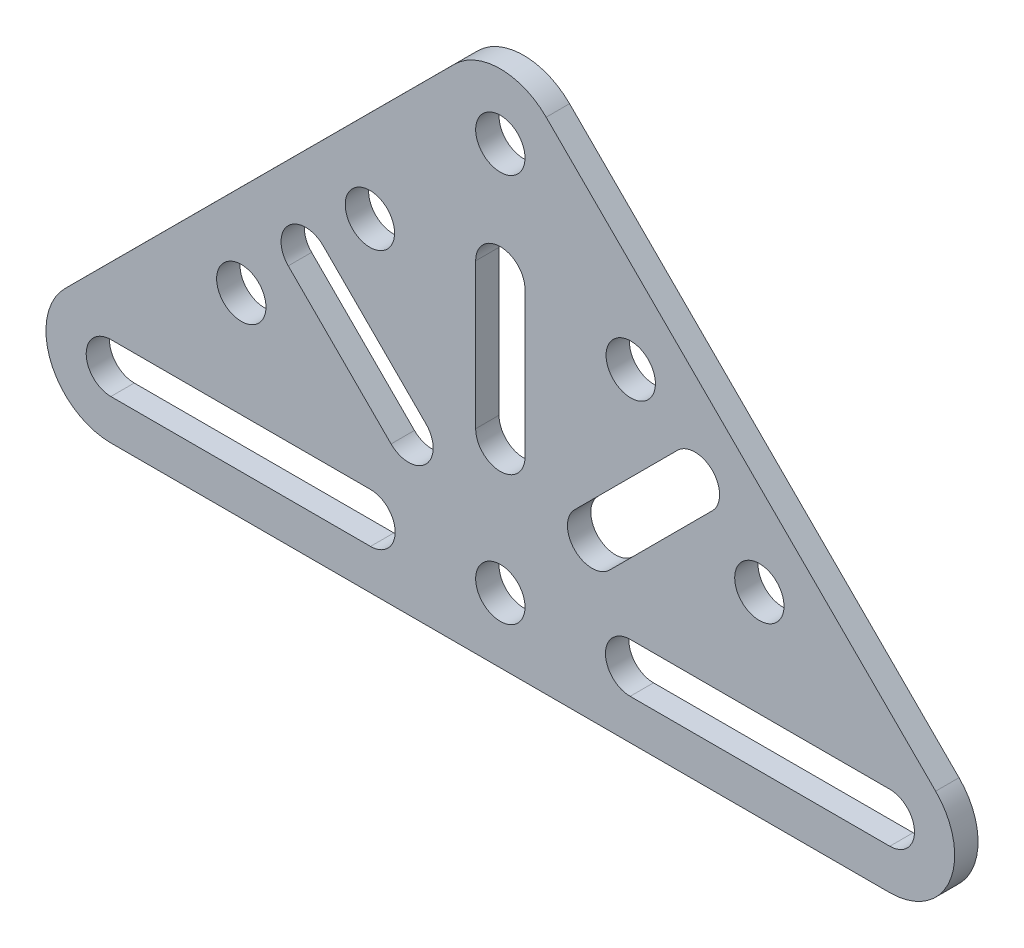
from build123d import *

# Parameters (mm, degrees)
BOSS_EXTRUDE1_DEPTH = 2.286
SKETCH2_R           = 2.413
CUT_EXTRUDE1_DEPTH  = 63.869828817
CUT_EXTRUDE2_DEPTH  = 63.869828817
CUT_EXTRUDE3_DEPTH  = 63.869828817
CIRPATTERN1_COUNT   = 3
CIRPATTERN1_ANGLE   = 90


with BuildPart() as part:
    # Sketch1 → Boss-Extrude1 (new body)
    with BuildSketch(Plane.XY):
        with BuildLine():
            Line((-42.58732985, 4.492924528), (-4.48732985, 42.545481657))
            ThreePointArc((-4.48732985, 42.545481657), (0, 44.402557128), (4.48732985, 42.545481657))
            Line((4.48732985, 42.545481657), (42.58732985, 4.492924528))
            ThreePointArc((42.58732985, 4.492924528), (43.967391701, -2.428212228), (38.1, -6.35))
            Line((38.1, -6.35), (-38.1, -6.35))
            ThreePointArc((-38.1, -6.35), (-43.967391701, -2.428212228), (-42.58732985, 4.492924528))
        make_face()
    extrude(amount=BOSS_EXTRUDE1_DEPTH)

    # Sketch2 → Cut-Extrude1 (cut, through all)
    with BuildSketch(Plane.XY.offset(2.286)):
        Circle(SKETCH2_R)
        with Locations((0, 38.052557128)):
            Circle(SKETCH2_R)
        with Locations((-25.34009434, 12.744016774)):
            Circle(SKETCH2_R)
        with Locations(Location((25.34009434, 12.744016774, 0), (0, 0, 180))):
            Circle(SKETCH2_R)
        with Locations((-12.75990566, 25.308540354)):
            Circle(SKETCH2_R)
        with Locations(Location((12.75990566, 25.308540354, 0), (0, 0, 180))):
            Circle(SKETCH2_R)
    extrude(amount=-CUT_EXTRUDE1_DEPTH, mode=Mode.SUBTRACT)

    # Sketch3 → Cut-Extrude2 (cut, through all)
    with BuildSketch(Plane.XY.offset(2.286)):
        with BuildLine():
            Line((-38.1, 2.413), (-12.7, 2.413))
            ThreePointArc((-12.7, 2.413), (-10.287, 0), (-12.7, -2.413))
            Line((-12.7, -2.413), (-38.1, -2.413))
            ThreePointArc((-38.1, -2.413), (-40.513, 0), (-38.1, 2.413))
        make_face()
    cut_extrude2 = extrude(amount=-CUT_EXTRUDE2_DEPTH, mode=Mode.SUBTRACT)

    # Mirror1: Cut-Extrude2 across plane
    add(cut_extrude2.mirror(Plane(origin=(0, 0, 0), x_dir=(0, 0, 1), z_dir=(1, 0, 0))), mode=Mode.SUBTRACT)

    # Sketch4 → Cut-Extrude3 (cut, through all)
    with BuildSketch(Plane.XY.offset(2.286)):
        with BuildLine():
            Line((-20.745443545, 17.332946219), (-10.687556689, 7.275059363))
            ThreePointArc((-10.687556689, 7.275059363), (-7.275059363, 7.275059363), (-7.275059363, 10.687556689))
            Line((-7.275059363, 10.687556689), (-17.332946219, 20.745443545))
            ThreePointArc((-17.332946219, 20.745443545), (-20.745443545, 20.745443545), (-20.745443545, 17.332946219))
        make_face()
    cut_extrude3 = extrude(amount=-CUT_EXTRUDE3_DEPTH, mode=Mode.SUBTRACT)

    # CirPattern1: Cut-Extrude3 ×3 about axis
    cirpattern1_axis = Axis((0, 0, 0), (0, 0, -1))
    for i in range(1, CIRPATTERN1_COUNT):
        add(cut_extrude3.rotate(cirpattern1_axis, i * CIRPATTERN1_ANGLE / (CIRPATTERN1_COUNT - 1)), mode=Mode.SUBTRACT)


solid = part.part
